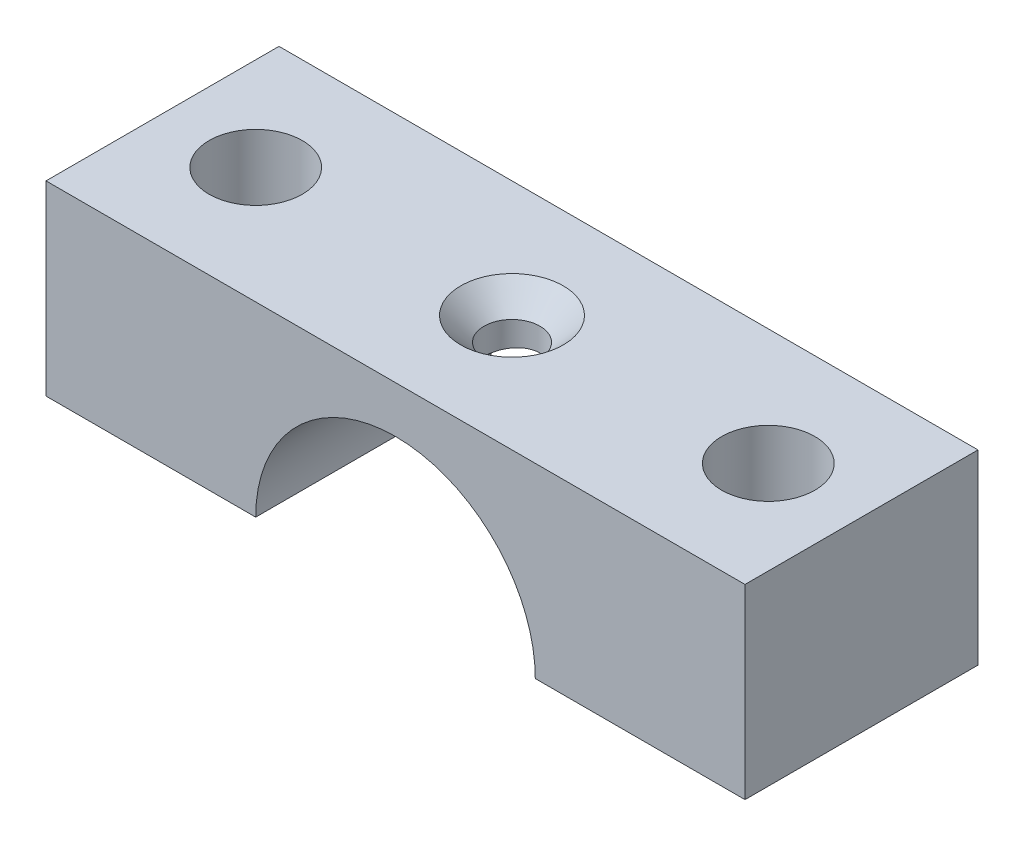
from build123d import *

# Parameters (mm, degrees)
BOSS_EXTRUDE1_DEPTH                             = 5
SKETCH2_R                                       = 2
CUT_EXTRUDE1_DEPTH                              = 18.720045147
CSK_FOR_M2_FLAT_HEAD_MACHINE_SCREW1_D           = 2.4
CSK_FOR_M2_FLAT_HEAD_MACHINE_SCREW1_CSINK_D     = 4.4
CSK_FOR_M2_FLAT_HEAD_MACHINE_SCREW1_CSINK_ANGLE = 90


with BuildPart() as part:
    # Sketch1 → Boss-Extrude1 (new, symmetric)
    with BuildSketch(Plane.XY):
        with BuildLine():
            Line((-6, 0), (-15, 0))
            Line((-15, 0), (-15, 8))
            Line((-15, 8), (15, 8))
            Line((15, 8), (15, 0))
            Line((15, 0), (6, 0))
            ThreePointArc((6, 0), (0, 6), (-6, 0))
        make_face()
    extrude(amount=BOSS_EXTRUDE1_DEPTH, both=True)

    # Sketch2 → Cut-Extrude1 (cut, through all)
    with BuildSketch(Plane(origin=(0, 8, 0), x_dir=(1, 0, 0), z_dir=(0, 1, 0))):
        with Locations(Location((-11, 0, 0), (0, 0, 270))):
            Circle(SKETCH2_R)
        with Locations(Location((11, 0, 0), (0, 0, 270))):
            Circle(SKETCH2_R)
    extrude(amount=-CUT_EXTRUDE1_DEPTH, mode=Mode.SUBTRACT)

    # CSK for M2 Flat Head Machine Screw1 (through all)
    with Locations(Plane(origin=(0, 8, 0), x_dir=(1, 0, 0), z_dir=(0, 1, 0))):
        with Locations((0, 0)):
            CounterSinkHole(CSK_FOR_M2_FLAT_HEAD_MACHINE_SCREW1_D / 2, CSK_FOR_M2_FLAT_HEAD_MACHINE_SCREW1_CSINK_D / 2, counter_sink_angle=CSK_FOR_M2_FLAT_HEAD_MACHINE_SCREW1_CSINK_ANGLE)


solid = part.part
